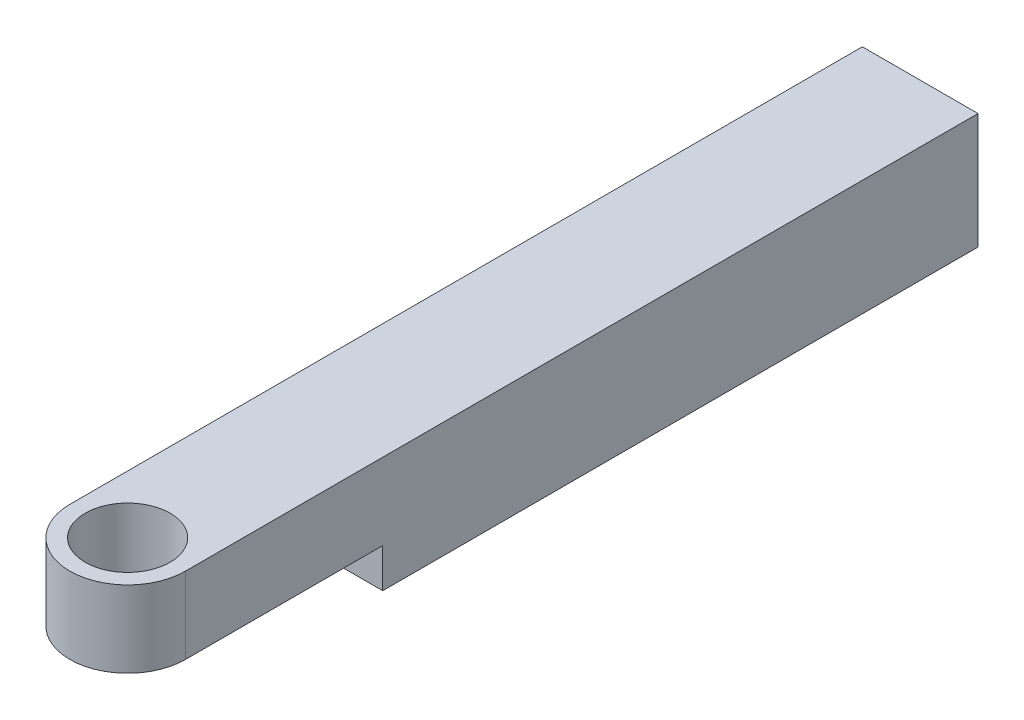
from build123d import *

# Parameters (mm, degrees)
SKETCH1_W           = 6.8
SKETCH1_H           = 6.8
SKETCH1_R           = 1.75
BOSS_EXTRUDE1_DEPTH = 50
CUT_EXTRUDE1_DEPTH  = 20
SKETCH5_W           = 6.8
SKETCH5_H           = 6.8
BOSS_EXTRUDE2_DEPTH = 7
SKETCH3_W           = 6.8
SKETCH3_H           = 2.3
CUT_EXTRUDE2_DEPTH  = 15
SKETCH4_R           = 2.5
CUT_EXTRUDE3_DEPTH  = 20
FILLET3_RADIUS      = 3.4
FILLET3_LENGTH      = 4.5


with BuildPart() as part:
    # Sketch1 → Boss-Extrude1 (new body)
    with BuildSketch(Plane.XY):
        with Locations((-3.4, 3.4)):
            Rectangle(SKETCH1_W, SKETCH1_H)
        with Locations((-3.4, 3.4)):
            Circle(SKETCH1_R, mode=Mode.SUBTRACT)
    extrude(amount=BOSS_EXTRUDE1_DEPTH)

    # Sketch2 → Cut-Extrude1 (cut)
    with BuildSketch(Plane(origin=(0, 0, 0), x_dir=(-1, 0, 0), z_dir=(0, 0, -1))):
        Polygon((6.575426481, 3.4), (4.98771324, 6.15), (1.81228676, 6.15), (0.224573519, 3.4), (1.81228676, 0.65), (4.98771324, 0.65), align=None)
    extrude(amount=-CUT_EXTRUDE1_DEPTH, mode=Mode.SUBTRACT)

    # Sketch5 → Boss-Extrude2 (add)
    with BuildSketch(Plane.XY.offset(50)):
        with Locations((-3.4, 3.4)):
            Rectangle(SKETCH5_W, SKETCH5_H)
    extrude(amount=-BOSS_EXTRUDE2_DEPTH)

    # Sketch3 → Cut-Extrude2 (cut)
    with BuildSketch(Plane.XY.offset(50)):
        with Locations((-3.4, 1.15)):
            Rectangle(SKETCH3_W, SKETCH3_H)
    extrude(amount=-CUT_EXTRUDE2_DEPTH, mode=Mode.SUBTRACT)

    # Sketch4 → Cut-Extrude3 (cut)
    with BuildSketch(Plane.XZ.offset(-2.3)):
        with Locations((-3.4, 46.6)):
            Circle(SKETCH4_R)
    extrude(amount=-CUT_EXTRUDE3_DEPTH, mode=Mode.SUBTRACT)

    # Fillet3: full round fillet: the end face becomes a half cylinder, R = half its width
    fillet3_face = Plane((-3.4, 4.55, 50), x_dir=(0, -1, 0), z_dir=(0, 0, 1))  # on the end face: x along it, z out of the body
    fillet3_slab = fillet3_face.offset(-FILLET3_RADIUS / 2) * Box(FILLET3_LENGTH, 2 * FILLET3_RADIUS, FILLET3_RADIUS, mode=Mode.PRIVATE)  # the body's end, R deep
    fillet3_round = Plane((-3.4, 4.55, 46.6), x_dir=(0, 0, 1), z_dir=(0, -1, 0)) * Cylinder(FILLET3_RADIUS, FILLET3_LENGTH, mode=Mode.PRIVATE)  # its axis R under the face
    add(fillet3_slab - fillet3_round, mode=Mode.SUBTRACT)


solid = part.part
